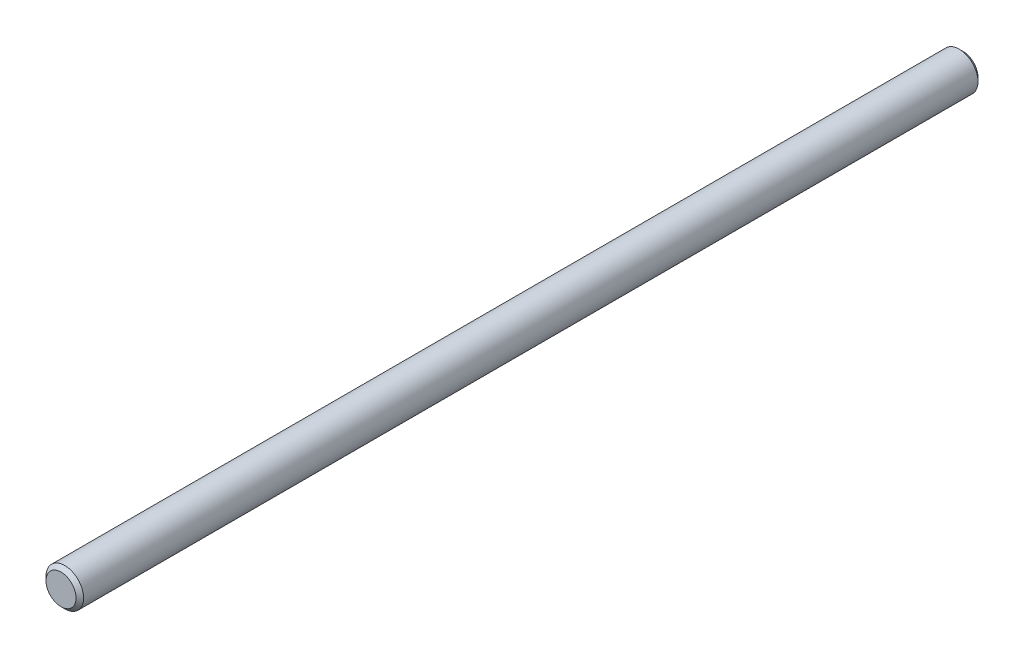
from build123d import *

# Parameters (mm, degrees)
SKETCH3_R           = 6.35
BOSS_EXTRUDE1_DEPTH = 152.4
CHAMFER1_SIZE       = 1.27


with BuildPart() as part:
    # Sketch3 → Boss-Extrude1 (new, symmetric)
    with BuildSketch(Plane.XY):
        with Locations(Location((0, 0, 0), (0, 0, 180))):
            Circle(SKETCH3_R)
    extrude(amount=BOSS_EXTRUDE1_DEPTH, both=True)

    # Chamfer1
    chamfer1_edges = [part.edges().sort_by_distance(p)[0] for p in [
        (6.35, 0, -152.4),
        (6.35, 0, 152.4),
    ]]
    chamfer(chamfer1_edges, length=CHAMFER1_SIZE)


solid = part.part
